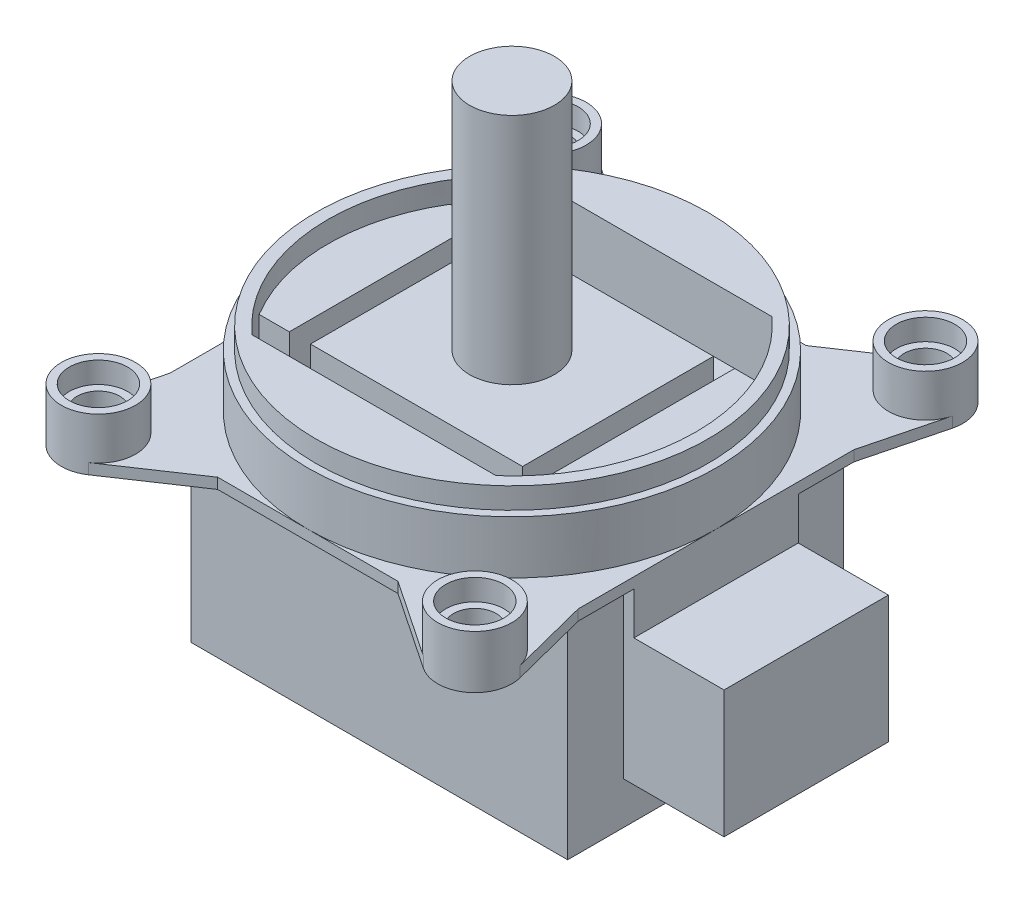
from build123d import *

# Parameters (mm, degrees)
SKETCH4_R           = 3.5
SKETCH4_R_2         = 19.25
BOSS_EXTRUDE1_DEPTH = 1
SKETCH5_R           = 19.25
BOSS_EXTRUDE2_DEPTH = 5
SKETCH6_R           = 18.5
BOSS_EXTRUDE3_DEPTH = 2
CUT_EXTRUDE1_DEPTH  = 6
SKETCH8_W           = 1
SKETCH8_H           = 25
CUT_EXTRUDE2_DEPTH  = 6
BOSS_EXTRUDE4_START = 4
SKETCH9_W           = 20
SKETCH9_H           = 18
BOSS_EXTRUDE4_DEPTH = 4
SKETCH10_R          = 4
BOSS_EXTRUDE5_DEPTH = 22
SKETCH11_R          = 3.5
BOSS_EXTRUDE6_DEPTH = 4
SKETCH12_R          = 2.75
CUT_EXTRUDE3_DEPTH  = 2
SKETCH13_R          = 1.5
CUT_EXTRUDE4_DEPTH  = 7
SKETCH14_W          = 35.5
SKETCH14_H          = 26
BOSS_EXTRUDE7_DEPTH = 20
BOSS_EXTRUDE8_DEPTH = 9.5
SKETCH16_W          = 15.5
SKETCH16_H          = 5
CUT_EXTRUDE5_DEPTH  = 8.5
SKETCH17_R          = 2
CUT_EXTRUDE6_DEPTH  = 4


with BuildPart() as part:
    # Sketch4 → Boss-Extrude1 (new body)
    with BuildSketch(Plane(origin=(0, 0, 0), x_dir=(1, 0, 0), z_dir=(0, 1, 0))):
        with Locations((-17.75, -21.25)):
            Circle(SKETCH4_R)
        with BuildLine():
            ThreePointArc((3e-08, -19.25), (-13.611805493, -13.611805583), (-19.25, -9.7e-08))
            Line((-19.25, -9.7e-08), (-19.25, -13))
            Line((-19.25, -13), (-21.140562134, -20.381617358))
            ThreePointArc((-21.140562134, -20.381617358), (-17.312374287, -17.777467245), (-14.25, -21.25))
            ThreePointArc((-14.25, -21.25), (-14.66103595, -22.895691677), (-15.797600627, -24.154847102))
            Line((-15.797600627, -24.154847102), (-8.5, -19.25))
            Line((-8.5, -19.25), (3e-08, -19.25))
        make_face()
        Circle(SKETCH4_R_2)
        with BuildLine():
            Line((19.25, -13), (19.25, 0))
            ThreePointArc((19.25, 0), (13.611805548, -13.611805527), (3e-08, -19.25))
            Line((3e-08, -19.25), (8.5, -19.25))
            Line((8.5, -19.25), (15.797600627, -24.154847102))
            ThreePointArc((15.797600627, -24.154847102), (15.7309919, -18.391048043), (21.140562134, -20.381617358))
            Line((21.140562134, -20.381617358), (19.25, -13))
        make_face()
        with Locations((17.75, -21.25)):
            Circle(SKETCH4_R)
        with BuildLine():
            Line((8.5, 19.25), (0, 19.25))
            ThreePointArc((0, 19.25), (13.611805538, 13.611805538), (19.25, 0))
            Line((19.25, 0), (19.25, 13))
            Line((19.25, 13), (21.140562134, 20.381617358))
            ThreePointArc((21.140562134, 20.381617358), (15.7309919, 18.391048043), (15.797600627, 24.154847102))
            Line((15.797600627, 24.154847102), (8.5, 19.25))
        make_face()
        with Locations((17.75, 21.25)):
            Circle(SKETCH4_R)
        with BuildLine():
            Line((-8.5, 19.25), (-15.797600627, 24.154847102))
            ThreePointArc((-15.797600627, 24.154847102), (-14.66103595, 22.895691677), (-14.25, 21.25))
            ThreePointArc((-14.25, 21.25), (-17.312374287, 17.777467245), (-21.140562134, 20.381617358))
            Line((-21.140562134, 20.381617358), (-19.25, 13))
            Line((-19.25, 13), (-19.25, -9.7e-08))
            ThreePointArc((-19.25, -9.7e-08), (-13.611805572, 13.611805504), (0, 19.25))
            Line((0, 19.25), (-8.5, 19.25))
        make_face()
        with Locations((-17.75, 21.25)):
            Circle(SKETCH4_R)
    extrude(amount=BOSS_EXTRUDE1_DEPTH)

    # Sketch5 → Boss-Extrude2 (add)
    with BuildSketch(Plane(origin=(0, 1, 0), x_dir=(1, 0, 0), z_dir=(0, 1, 0))):
        with Locations(Location((0, 0, 0), (0, 0, 270))):
            Circle(SKETCH5_R)
    extrude(amount=BOSS_EXTRUDE2_DEPTH)

    # Sketch6 → Boss-Extrude3 (add)
    with BuildSketch(Plane(origin=(0, 6, 0), x_dir=(1, 0, 0), z_dir=(0, 1, 0))):
        with Locations(Location((0, 0, 0), (0, 0, 270))):
            Circle(SKETCH6_R)
    extrude(amount=BOSS_EXTRUDE3_DEPTH)

    # Sketch7 → Cut-Extrude1 (cut)
    with BuildSketch(Plane(origin=(0, 8, 0), x_dir=(1, 0, 0), z_dir=(0, 1, 0))):
        with BuildLine():
            Line((-11.5, 13), (11.5, 13))
            ThreePointArc((11.5, 13), (17.356554958, 0), (11.5, -13))
            Line((11.5, -13), (-11.5, -13))
            ThreePointArc((-11.5, -13), (-17.356554958, 0), (-11.5, 13))
        make_face()
    extrude(amount=-CUT_EXTRUDE1_DEPTH, mode=Mode.SUBTRACT)

    # Sketch8 → Cut-Extrude2 (cut)
    with BuildSketch(Plane(origin=(0, 2, 0), x_dir=(1, 0, 0), z_dir=(0, 1, 0))):
        with Locations((-11, 0)):
            Rectangle(SKETCH8_W, SKETCH8_H)
        with Locations((11, 0)):
            Rectangle(SKETCH8_W, SKETCH8_H)
    extrude(amount=-CUT_EXTRUDE2_DEPTH, mode=Mode.SUBTRACT)

    # Sketch9 → Boss-Extrude4 (add)
    with BuildSketch(Plane(origin=(0, 2, 0), x_dir=(1, 0, 0), z_dir=(0, 1, 0)).offset(BOSS_EXTRUDE4_START)):
        Rectangle(SKETCH9_W, SKETCH9_H)
        with BuildLine():
            Line((-14.84082208, 9), (-12, 9))
            Line((-12, 9), (-12, -9))
            Line((-12, -9), (-14.84082208, -9))
            ThreePointArc((-14.84082208, -9), (-17.356554958, 0), (-14.84082208, 9))
        make_face()
        with BuildLine():
            Line((12, -9), (14.84082208, -9))
            ThreePointArc((14.84082208, -9), (17.356554958, 0), (14.84082208, 9))
            Line((14.84082208, 9), (12, 9))
            Line((12, 9), (12, -9))
        make_face()
    extrude(amount=-BOSS_EXTRUDE4_DEPTH)

    # Sketch10 → Boss-Extrude5 (add)
    with BuildSketch(Plane(origin=(0, 6, 0), x_dir=(1, 0, 0), z_dir=(0, 1, 0))):
        with Locations(Location((0, 0, 0), (0, 0, 270))):
            Circle(SKETCH10_R)
    extrude(amount=BOSS_EXTRUDE5_DEPTH)

    # Sketch11 → Boss-Extrude6 (add)
    with BuildSketch(Plane(origin=(0, 1, 0), x_dir=(1, 0, 0), z_dir=(0, 1, 0))):
        with Locations(Location((-17.75, 21.25, 0), (0, 0, 56.094250748))):
            Circle(SKETCH11_R)
        with Locations(Location((17.75, 21.25, 0), (0, 0, 123.905749252))):
            Circle(SKETCH11_R)
        with Locations(Location((17.75, -21.25, 0), (0, 0, 14.365660019))):
            Circle(SKETCH11_R)
        with Locations(Location((-17.75, -21.25, 0), (0, 0, 165.634339981))):
            Circle(SKETCH11_R)
    extrude(amount=BOSS_EXTRUDE6_DEPTH)

    # Sketch12 → Cut-Extrude3 (cut)
    with BuildSketch(Plane(origin=(0, 5, 0), x_dir=(1, 0, 0), z_dir=(0, 1, 0))):
        with Locations(Location((-17.75, 21.25, 0), (0, 0, 270))):
            Circle(SKETCH12_R)
        with Locations(Location((17.75, 21.25, 0), (0, 0, 270))):
            Circle(SKETCH12_R)
        with Locations(Location((17.75, -21.25, 0), (0, 0, 270))):
            Circle(SKETCH12_R)
        with Locations(Location((-17.75, -21.25, 0), (0, 0, 270))):
            Circle(SKETCH12_R)
    extrude(amount=-CUT_EXTRUDE3_DEPTH, mode=Mode.SUBTRACT)

    # Sketch13 → Cut-Extrude4 (cut)
    with BuildSketch(Plane(origin=(0, 3, 0), x_dir=(1, 0, 0), z_dir=(0, 1, 0))):
        with Locations(Location((-17.75, 21.25, 0), (0, 0, 270))):
            Circle(SKETCH13_R)
        with Locations(Location((17.75, 21.25, 0), (0, 0, 270))):
            Circle(SKETCH13_R)
        with Locations(Location((17.75, -21.25, 0), (0, 0, 270))):
            Circle(SKETCH13_R)
        with Locations(Location((-17.75, -21.25, 0), (0, 0, 270))):
            Circle(SKETCH13_R)
    extrude(amount=-CUT_EXTRUDE4_DEPTH, mode=Mode.SUBTRACT)

    # Sketch14 → Boss-Extrude7 (add)
    with BuildSketch(Plane.XZ):
        with Locations((0.5, 0)):
            Rectangle(SKETCH14_W, SKETCH14_H)
    extrude(amount=BOSS_EXTRUDE7_DEPTH)

    # Sketch15 → Boss-Extrude8 (add)
    with BuildSketch(Plane(origin=(18.25, 0, 0), x_dir=(0, 0, -1), z_dir=(1, 0, 0))):
        Polygon((-7.75, 0), (-7.75, -16), (7.75, -16), (7.75, 0), (7.75, 1), (-7.75, 1), align=None)
    extrude(amount=BOSS_EXTRUDE8_DEPTH)

    # Sketch16 → Cut-Extrude5 (cut)
    with BuildSketch(Plane(origin=(27.75, 0, 0), x_dir=(0, 0, -1), z_dir=(1, 0, 0))):
        with Locations((0, -1.5)):
            Rectangle(SKETCH16_W, SKETCH16_H)
    extrude(amount=-CUT_EXTRUDE5_DEPTH, mode=Mode.SUBTRACT)

    # Sketch17 → Cut-Extrude6 (cut)
    with BuildSketch(Plane.XZ):
        with Locations(Location((-17.75, 21.25, 0), (0, 0, 270))):
            Circle(SKETCH17_R)
        with Locations(Location((17.75, 21.25, 0), (0, 0, 270))):
            Circle(SKETCH17_R)
        with Locations(Location((17.75, -21.25, 0), (0, 0, 270))):
            Circle(SKETCH17_R)
        with Locations(Location((-17.75, -21.25, 0), (0, 0, 270))):
            Circle(SKETCH17_R)
    extrude(amount=-CUT_EXTRUDE6_DEPTH, mode=Mode.SUBTRACT)


solid = part.part
